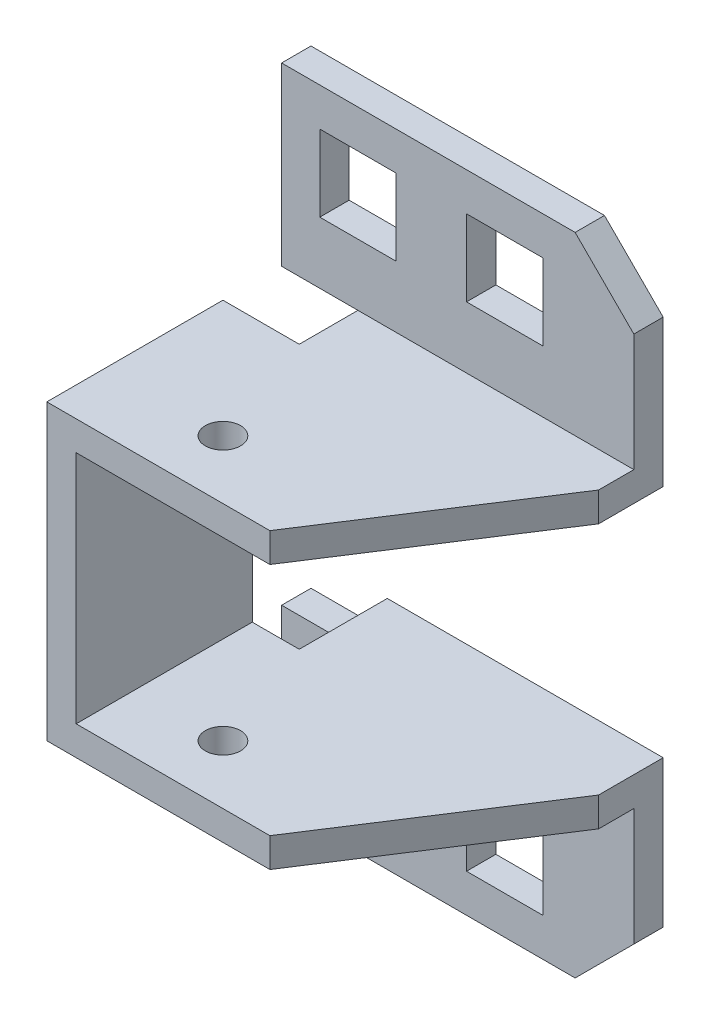
from build123d import *

# Parameters (mm, degrees)
BOSS_EXTRUDE4_DEPTH   = 5
BOSS_EXTRUDE4_2_DEPTH = 5
SKETCH3_W             = 13
SKETCH3_H             = 13
CUT_EXTRUDE2_DEPTH    = 126.39936204
BOSS_EXTRUDE5_DEPTH   = 5
BOSS_EXTRUDE6_START   = 50
BOSS_EXTRUDE6_DEPTH   = 5
SKETCH5_W             = 5
SKETCH5_H             = 30
BOSS_EXTRUDE7_DEPTH   = 40
SKETCH6_R             = 3
CUT_EXTRUDE3_DEPTH    = 110.658560997


with BuildPart() as part:
    # Sketch1 → Boss-Extrude4 (new body)
    with BuildSketch(Plane.XY):
        Polygon((0, 0), (50, 0), (60, 10), (60, 30), (0, 30), align=None)
    extrude(amount=BOSS_EXTRUDE4_DEPTH)


with BuildPart() as body_2:
    # Sketch1 → Boss-Extrude4 2 (new body)
    with BuildSketch(Plane.XY):
        Polygon((0, 80), (0, 110), (50, 110), (60, 100), (60, 80), align=None)
    extrude(amount=BOSS_EXTRUDE4_2_DEPTH)


with BuildPart() as cut_extrude2_tool:
    # Sketch3 → Cut-Extrude2 (new, through all)
    with BuildSketch(Plane.XY.offset(5)):
        with Locations((13, 97)):
            Rectangle(SKETCH3_W, SKETCH3_H)
        with Locations((38, 97)):
            Rectangle(SKETCH3_W, SKETCH3_H)
        with Locations((13, 13)):
            Rectangle(SKETCH3_W, SKETCH3_H)
        with Locations((38, 13)):
            Rectangle(SKETCH3_W, SKETCH3_H)
    extrude(amount=-CUT_EXTRUDE2_DEPTH)


with BuildPart() as part_1:
    add(part.part)

    # Cut-Extrude2: cut by cut_extrude2_tool
    add(cut_extrude2_tool.part, mode=Mode.SUBTRACT)

    # Sketch4 → Boss-Extrude5 (add)
    with BuildSketch(Plane(origin=(0, 30, 0), x_dir=(1, 0, 0), z_dir=(0, 1, 0))):
        Polygon((60, -5), (60, -11), (38, -45), (0, -45), (0, -15), (13, -15), (13, -5), (13, 0), (60, 0), align=None)
    extrude(amount=BOSS_EXTRUDE5_DEPTH)



with BuildPart() as body_2_1:
    add(body_2.part)

    # Cut-Extrude2: cut by cut_extrude2_tool
    add(cut_extrude2_tool.part, mode=Mode.SUBTRACT)

    # Sketch4<2> → Boss-Extrude6 (add)
    with BuildSketch(Plane(origin=(0, 30, 0), x_dir=(1, 0, 0), z_dir=(0, 1, 0)).offset(BOSS_EXTRUDE6_START)):
        Polygon((60, -5), (60, -11), (38, -45), (0, -45), (0, -15), (13, -15), (13, -5), (13, 0), (60, 0), align=None)
    extrude(amount=-BOSS_EXTRUDE6_DEPTH)


with BuildPart() as part_2:
    add(part_1.part)

    add(body_2_1.part)  # Boss-Extrude7 merges body 2
    # Sketch5 → Boss-Extrude7 (add)
    with BuildSketch(Plane(origin=(0, 35, 0), x_dir=(1, 0, 0), z_dir=(0, 1, 0))):
        with Locations((2.5, -30)):
            Rectangle(SKETCH5_W, SKETCH5_H)
    extrude(amount=BOSS_EXTRUDE7_DEPTH)

    # Sketch6 → Cut-Extrude3 (cut, through all)
    with BuildSketch(Plane(origin=(0, 80, 0), x_dir=(1, 0, 0), z_dir=(0, 1, 0))):
        with Locations(Location((20, -35, 0), (0, 0, 180))):
            Circle(SKETCH6_R)
    extrude(amount=-CUT_EXTRUDE3_DEPTH, mode=Mode.SUBTRACT)


solid = part_2.part
